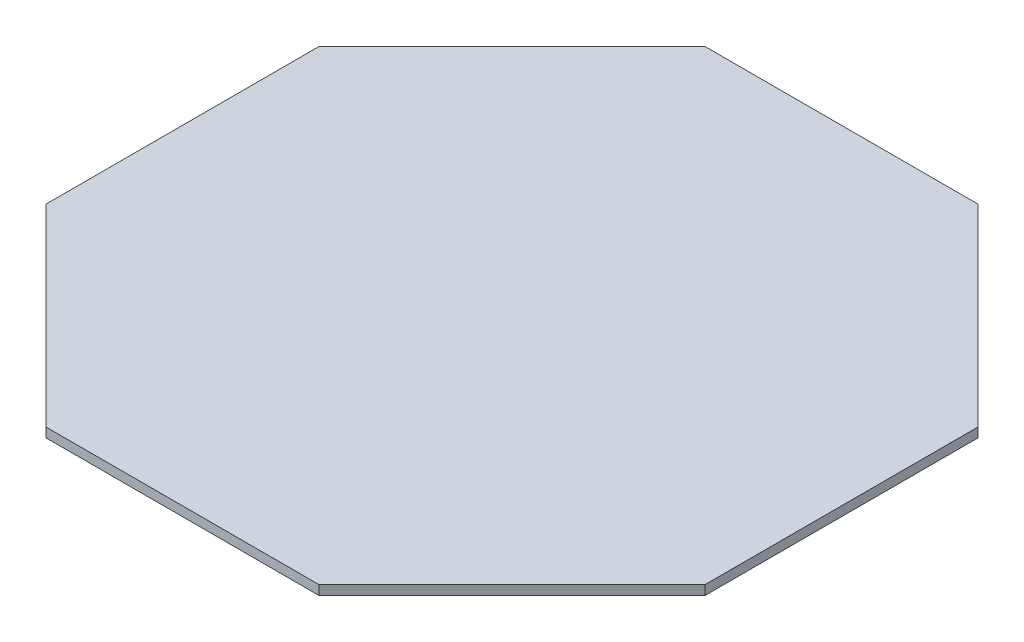
from build123d import *

# Parameters (mm, degrees)
BOSS_EXTRUDE1_DEPTH = 3
CIRPATTERN1_COUNT   = 8


with BuildPart() as part:
    # Sketch1 → Boss-Extrude1 (new body)
    with BuildSketch(Plane(origin=(0, 0, 0), x_dir=(1, 0, 0), z_dir=(0, 1, 0))):
        Polygon((0, 0), (105.018289963, 0), (105.018289963, 43.5), (74.259144982, 74.259144982), align=None)
    boss_extrude1 = extrude(amount=BOSS_EXTRUDE1_DEPTH)

    # CirPattern1: Boss-Extrude1 ×8 about axis
    cirpattern1_axis = Axis((0, 0, 0), (0, 1, 0))
    for i in range(1, CIRPATTERN1_COUNT):
        add(boss_extrude1.rotate(cirpattern1_axis, i * 360 / CIRPATTERN1_COUNT))


solid = part.part
